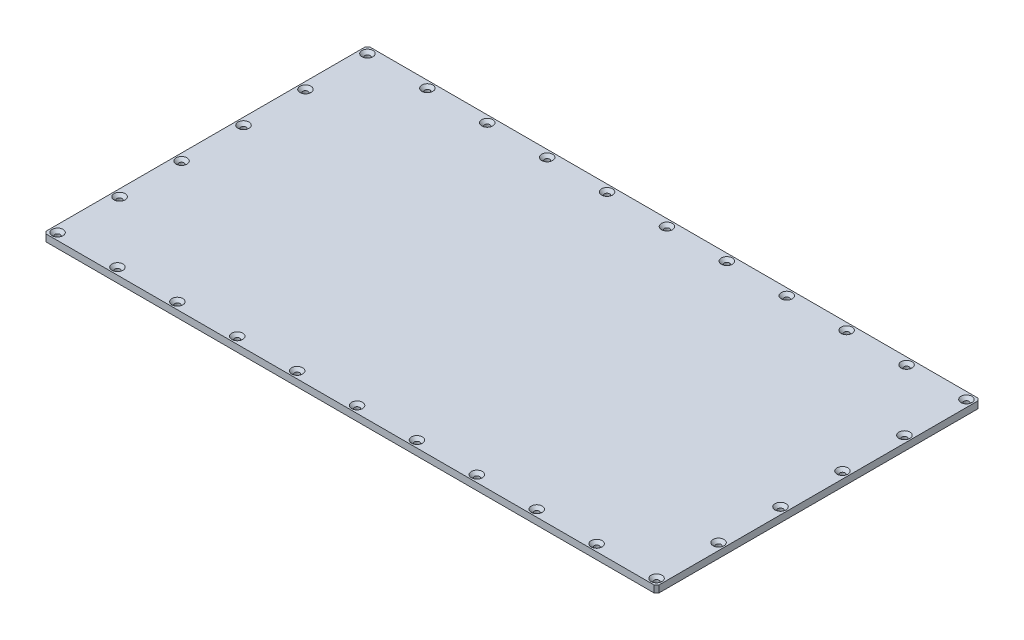
from build123d import *
from build123d.topology import SkipClean

# Parameters (mm, degrees)
SKETCH1_R           = 2.25
BOSS_EXTRUDE1_DEPTH = 6
CHAMFER1_SIZE       = 2.5
CHAMFER2_SIZE       = 2


with BuildPart() as part:
    # Sketch1 → Boss-Extrude1 (new body)
    with BuildSketch(Plane(origin=(0, 0, 0), x_dir=(1, 0, 0), z_dir=(0, 1, 0))):
        with BuildLine():
            Line((265, -131.75), (265, 0))
            Line((265, 0), (0, 0))
            Line((0, 0), (0, -140))
            Line((0, -140), (265, -140))
            Line((265, -140), (265, -136.25))
            ThreePointArc((265, -136.25), (262.75, -134), (265, -131.75))
        make_face()
        with Locations(Location((6, -26.8, 0), (0, 0, 270))):
            Circle(SKETCH1_R, mode=Mode.SUBTRACT)
        with Locations(Location((6, -80.4, 0), (0, 0, 270))):
            Circle(SKETCH1_R, mode=Mode.SUBTRACT)
        with Locations(Location((6, -134, 0), (0, 0, 270))):
            Circle(SKETCH1_R, mode=Mode.SUBTRACT)
        with Locations(Location((57.8, -134, 0), (0, 0, 270))):
            Circle(SKETCH1_R, mode=Mode.SUBTRACT)
        with Locations(Location((109.6, -134, 0), (0, 0, 270))):
            Circle(SKETCH1_R, mode=Mode.SUBTRACT)
        with Locations(Location((161.4, -134, 0), (0, 0, 270))):
            Circle(SKETCH1_R, mode=Mode.SUBTRACT)
        with Locations(Location((213.2, -134, 0), (0, 0, 270))):
            Circle(SKETCH1_R, mode=Mode.SUBTRACT)
    extrude(amount=BOSS_EXTRUDE1_DEPTH)

    # Chamfer1
    chamfer1_edges = [part.edges().sort_by_distance(p)[0] for p in [
        (262.75, 6, 134),
        (57.8, 6, 131.75),
        (109.6, 6, 131.75),
        (6, 6, 131.75),
        (6, 6, 78.15),
        (6, 6, 24.55),
        (213.2, 6, 131.75),
        (161.4, 6, 131.75),
    ]]
    chamfer(chamfer1_edges, length=CHAMFER1_SIZE)

    # Mirror3: part across plane


with BuildPart() as part_1:
    with SkipClean():  # the faces are left unmerged after this step: merging them gives an invalid solid
        add(part.part)
        add(part.part.mirror(Plane(origin=(265, 6, 131.75), x_dir=(0, 0, 1), z_dir=(-1, 0, 0))))

    # Mirror4: part across plane


with BuildPart() as part_2:
    with SkipClean():  # the faces are left unmerged after this step: merging them gives an invalid solid
        add(part_1.part)
        add(part_1.part.mirror(Plane(origin=(0, 6, 0), x_dir=(1, 0, 0), z_dir=(0, 0, -1))))

    # Chamfer2
    chamfer2_edges = [part_2.edges().sort_by_distance(p)[0] for p in [
        (0, 3, 140),
        (530, 3, -140),
        (0, 3, -140),
        (530, 3, 140),
    ]]
    chamfer(chamfer2_edges, length=CHAMFER2_SIZE)


solid = part_2.part
